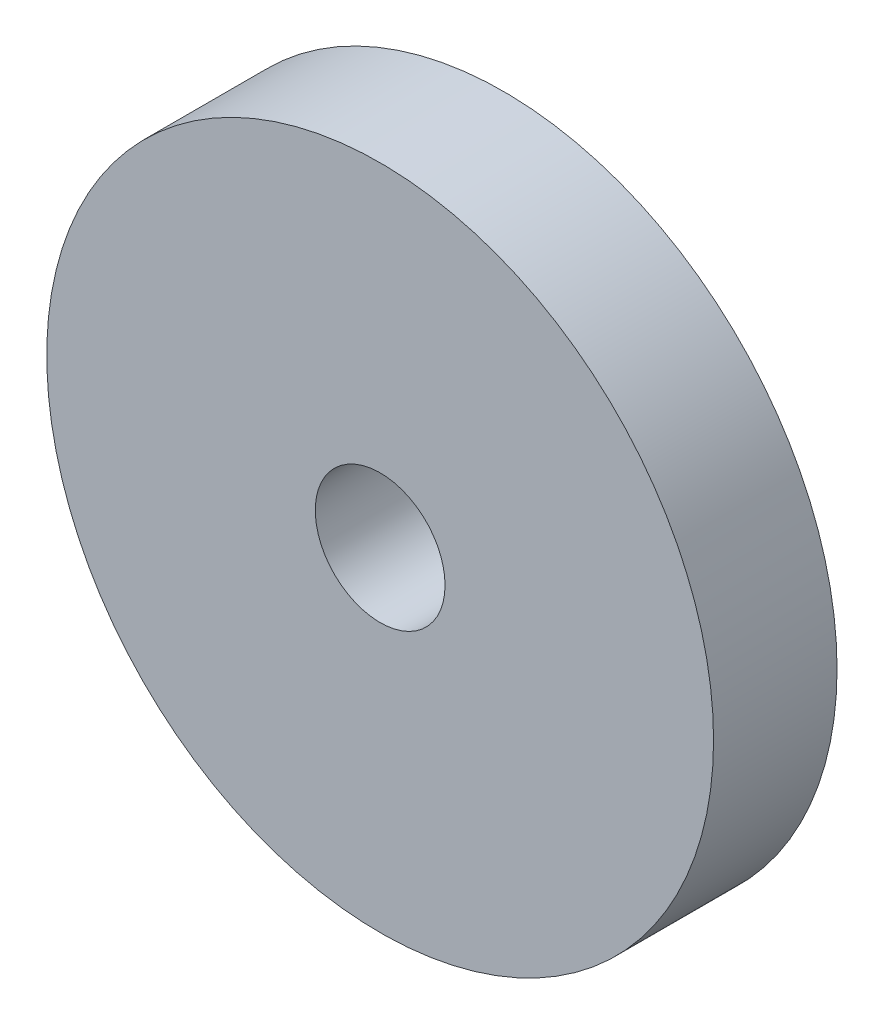
from build123d import *

# Parameters (mm, degrees)
SKETCH2_R           = 13.5
BOSS_EXTRUDE1_DEPTH = 5
SKETCH3_R           = 2.627
CUT_EXTRUDE1_DEPTH  = 5


with BuildPart() as part:
    # Sketch2 → Boss-Extrude1 (new body)
    with BuildSketch(Plane.XY):
        Circle(SKETCH2_R)
    extrude(amount=BOSS_EXTRUDE1_DEPTH)

    # Sketch3 → Cut-Extrude1 (cut)
    with BuildSketch(Plane.XY.offset(5)):
        Circle(SKETCH3_R)
    extrude(amount=-CUT_EXTRUDE1_DEPTH, mode=Mode.SUBTRACT)


solid = part.part
